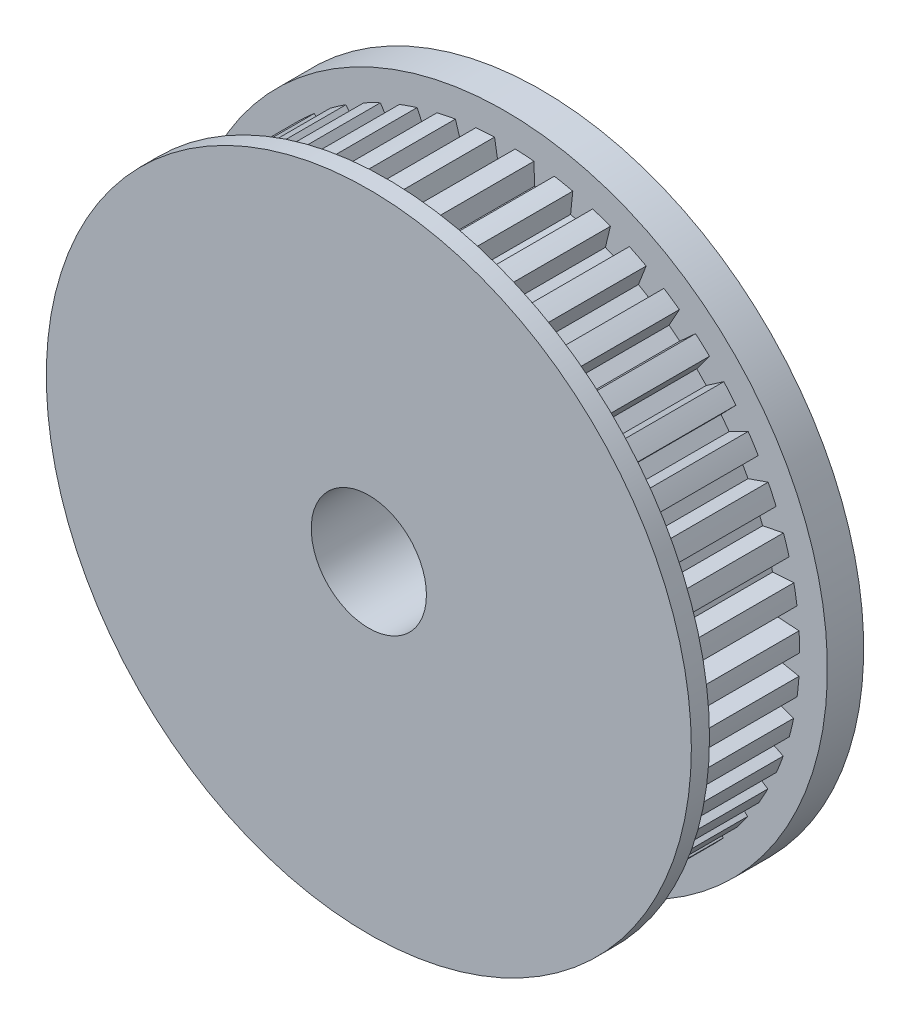
from build123d import *

# Parameters (mm, degrees)
SKETCH3_R               = 16.25
BOSS_EXTRUDE2_DEPTH     = 3.25
CUT_EXTRUDE2_DEPTH      = 24.209642393
CIRPATTERN3_COUNT       = 47
SKETCH5_R               = 17.78
BOSS_EXTRUDE3_DEPTH     = 2
BOSS_EXTRUDE4_START     = 1
SKETCH6_R               = 17.78
BOSS_EXTRUDE4_DEPTH     = 1
CUT_EXTRUDE3_DEPTH      = 27.879486602
CUT_EXTRUDE3_DEPTH_BACK = 27.879486602
SKETCH7_R               = 3.175


with BuildPart() as part:
    # Sketch3 → Boss-Extrude2 (new, symmetric)
    with BuildSketch(Plane.XY):
        with Locations(Location((0, 0, 0), (0, 0, 180))):
            Circle(SKETCH3_R)
    extrude(amount=BOSS_EXTRUDE2_DEPTH, both=True)

    # Sketch1 → Cut-Extrude2 (cut, symmetric)
    with BuildSketch(Plane.XY):
        Polygon((-0.375, 15.08), (0.375, 15.08), (0.654345854, 16.756075122), (-0.654345854, 16.756075122), align=None)
    cut_extrude2 = extrude(amount=CUT_EXTRUDE2_DEPTH, both=True, mode=Mode.SUBTRACT)

    # CirPattern3: Cut-Extrude2 ×47 about axis
    cirpattern3_axis = Axis((0, 0, 0), (0, 0, 1))
    for i in range(1, CIRPATTERN3_COUNT):
        add(cut_extrude2.rotate(cirpattern3_axis, i * 360 / CIRPATTERN3_COUNT), mode=Mode.SUBTRACT)

    # Sketch5 → Boss-Extrude3 (add)
    with BuildSketch(Plane(origin=(0, 0, -3.25), x_dir=(-1, 0, 0), z_dir=(0, 0, -1))):
        Circle(SKETCH5_R)
    extrude(amount=BOSS_EXTRUDE3_DEPTH)

    # Sketch6 → Boss-Extrude4 (add)
    with BuildSketch(Plane.XY.offset(3.25).offset(BOSS_EXTRUDE4_START)):
        with Locations(Location((0, 0, 0), (0, 0, 180))):
            Circle(SKETCH6_R)
    extrude(amount=-BOSS_EXTRUDE4_DEPTH)

    # Sketch7 → Cut-Extrude3 (cut, two sides: drawn at the far end of the back side and taken through both)
    with BuildSketch(Plane.XY.offset(4.25).offset(-CUT_EXTRUDE3_DEPTH_BACK)):
        Circle(SKETCH7_R)
    extrude(amount=CUT_EXTRUDE3_DEPTH + CUT_EXTRUDE3_DEPTH_BACK, mode=Mode.SUBTRACT)


solid = part.part
